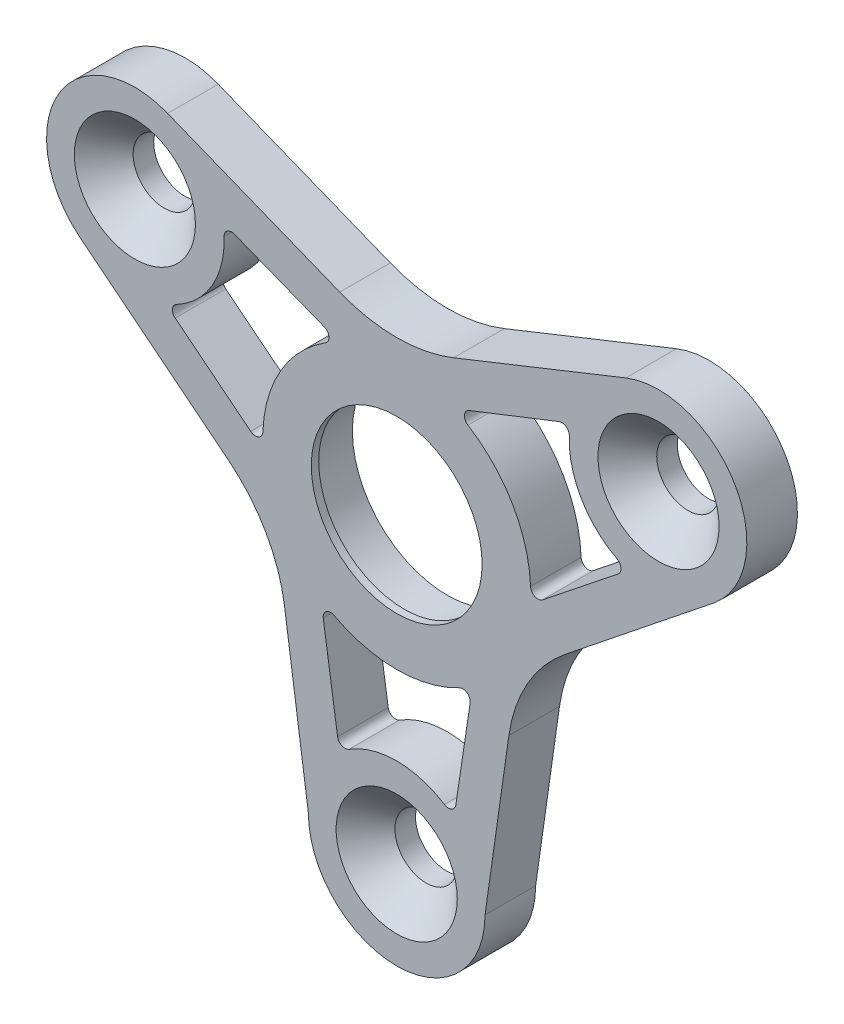
from build123d import *

# Parameters (mm, degrees)
SKETCH_1_R          = 5.935
SKETCH_1_R_2        = 2.095
SKETCH_1_R_3        = 5.74
EXTRUDE_1_DEPTH     = 3.4
SKETCH_3_R          = 6.38
CUT_EXTRUDE_1_DEPTH = 2.9
SKETCH_4_R          = 4.5
EXTRUDE_3_DEPTH     = 0.56
SKETCH_6_R          = 3.15
CUT_EXTRUDE_2_DEPTH = 0.6
SKETCH_7_R          = 3.15
CUT_EXTRUDE_3_DEPTH = 0.6
SKETCH_8_R          = 3.15
CUT_EXTRUDE_4_DEPTH = 0.6
CUT_EXTRUDE_5_DEPTH = 10
SKETCH_13_R         = 4.5
SKETCH_13_R_2       = 3.15
CUT_EXTRUDE_6_DEPTH = 0.37
SKETCH_14_R         = 4.5
SKETCH_14_R_2       = 3.15
CUT_EXTRUDE_7_DEPTH = 0.37
SKETCH_15_R         = 4.5
SKETCH_15_R_2       = 3.15
CUT_EXTRUDE_8_DEPTH = 0.37


with BuildPart() as part:
    # 草图1 → 凸台-拉伸1 (new body)
    # profile 1 of 4: a face of its own
    with BuildSketch(Plane.XY):
        with Locations((-17.593306078, 10.1575)):
            Circle(SKETCH_1_R)
        with Locations((-17.593306078, 10.1575)):
            Circle(SKETCH_1_R_2, mode=Mode.SUBTRACT)
    # profile 2 of 4: a face of its own
    with BuildSketch(Plane.XY):
        with Locations((17.593306078, 10.1575)):
            Circle(SKETCH_1_R)
        with Locations((17.593306078, 10.1575)):
            Circle(SKETCH_1_R_2, mode=Mode.SUBTRACT)
    # profile 3 of 4: a face of its own
    with BuildSketch(Plane.XY):
        with BuildLine():
            Line((-3.823709102, 11.054508427), (-15.39430283, 15.670086481))
            ThreePointArc((-15.39430283, 15.670086481), (-12.680297362, 13.487150186), (-11.658306078, 10.1575))
            ThreePointArc((-11.658306078, 10.1575), (-15.021547784, 4.808641778), (-21.299513922, 5.521958132))
            Line((-21.299513922, 5.521958132), (-11.31029049, -2.464624515))
            ThreePointArc((-11.31029049, -2.464624515), (-8.793601867, -5.406520994), (-7.538053442, -9.068770941))
            Line((-7.538053442, -9.068770941), (-5.935, -20.315))
            ThreePointArc((-5.935, -20.315), (0, -14.38), (5.935, -20.315))
            Line((5.935, -20.315), (7.538053442, -9.068770941))
            ThreePointArc((7.538053442, -9.068770941), (8.793601867, -5.406520994), (11.31029049, -2.464624515))
            Line((11.31029049, -2.464624515), (21.299513922, 5.521958132))
            ThreePointArc((21.299513922, 5.521958132), (12.46358448, 7.172507316), (15.39430283, 15.670086481))
            Line((15.39430283, 15.670086481), (3.823709102, 11.054508427))
            ThreePointArc((3.823709102, 11.054508427), (0, 10.32), (-3.823709102, 11.054508427))
        make_face()
        Circle(SKETCH_1_R_3, mode=Mode.SUBTRACT)
    # profile 4 of 4: a face of its own
    with BuildSketch(Plane.XY):
        with Locations((0, -20.315)):
            Circle(SKETCH_1_R)
        with Locations((0, -20.315)):
            Circle(SKETCH_1_R_2, mode=Mode.SUBTRACT)
    extrude(amount=EXTRUDE_1_DEPTH)

    # 草图3 → 切除-拉伸1 (cut)
    with BuildSketch(Plane(origin=(0, 0, 0), x_dir=(-1, 0, 0), z_dir=(0, 0, -1))):
        Circle(SKETCH_3_R)
    extrude(amount=-CUT_EXTRUDE_1_DEPTH, mode=Mode.SUBTRACT)

    # 草图4 → 凸台-拉伸3 (add)
    with BuildSketch(Plane(origin=(0, 0, 0), x_dir=(-1, 0, 0), z_dir=(0, 0, -1))):
        with Locations(Location((0, -20.315, 0), (0, 0, 180))):
            Circle(SKETCH_4_R)
        with Locations(Location((17.593306078, 10.1575, 0), (0, 0, 180))):
            Circle(SKETCH_4_R)
        with Locations(Location((-17.593306078, 10.1575, 0), (0, 0, 180))):
            Circle(SKETCH_4_R)
    extrude(amount=EXTRUDE_3_DEPTH)

    # 草图6 → 切除-拉伸2 (cut)
    with BuildSketch(Plane(origin=(0, 0, -0.56), x_dir=(-1, 0, 0), z_dir=(0, 0, -1))):
        with Locations((0, -20.315)):
            Circle(SKETCH_6_R)
    extrude(amount=-CUT_EXTRUDE_2_DEPTH, mode=Mode.SUBTRACT)

    # 草图7 → 切除-拉伸3 (cut)
    with BuildSketch(Plane(origin=(0, 0, -0.56), x_dir=(-1, 0, 0), z_dir=(0, 0, -1))):
        with Locations((-17.593306078, 10.1575)):
            Circle(SKETCH_7_R)
    extrude(amount=-CUT_EXTRUDE_3_DEPTH, mode=Mode.SUBTRACT)

    # 草图8 → 切除-拉伸4 (cut)
    with BuildSketch(Plane(origin=(0, 0, -0.56), x_dir=(-1, 0, 0), z_dir=(0, 0, -1))):
        with Locations((17.593306078, 10.1575)):
            Circle(SKETCH_8_R)
    extrude(amount=-CUT_EXTRUDE_4_DEPTH, mode=Mode.SUBTRACT)

    # 草图9 → 切除-旋转1 (revolve, cut)
    with BuildSketch(Plane(origin=(0, 10.1575, 0), x_dir=(-1, 0, 0), z_dir=(0, -1, 0))):
        Polygon((19.688306078, -3.4), (19.688306078, -1.425), (21.663306078, -3.4), align=None)
    revolve(axis=Axis((-17.593306078, 10.1575, 3.4), (0, 0, -1)), mode=Mode.SUBTRACT)

    # 草图10 → 切除-旋转2 (revolve, cut)
    with BuildSketch(Plane(origin=(8.796653039, -5.07875, 0), x_dir=(0, 0, 1), z_dir=(-0.8660254037844397, 0.49999999999999806, 0)), mode=Mode.PRIVATE) as cut_revolve_2_sk:
        Polygon((3.4, 19.688306078), (3.4, 21.663306078), (1.425, 19.688306078), align=None)
    revolve(cut_revolve_2_sk.sketch.rotate(Axis((17.593306078, 10.1575, 3.4), (0, 0, -1)), 240), axis=Axis((17.593306078, 10.1575, 3.4), (0, 0, -1)), mode=Mode.SUBTRACT)

    # 草图11 → 切除-旋转3 (revolve, cut)
    with BuildSketch(Plane(origin=(8.796653039, -5.07875, 0), x_dir=(0, 0, 1), z_dir=(-0.8660254037844397, 0.49999999999999806, 0)), mode=Mode.PRIVATE) as cut_revolve_3_sk:
        Polygon((3.4, -15.498306078), (3.4, -13.523306078), (1.425, -15.498306078), align=None)
    revolve(cut_revolve_3_sk.sketch.rotate(Axis((0, -20.315, 3.4), (0, 0, -1)), 240), axis=Axis((0, -20.315, 3.4), (0, 0, -1)), mode=Mode.SUBTRACT)

    # 草图12 → 切除-拉伸5 (cut)
    with BuildSketch(Plane(origin=(0, 0, 0), x_dir=(-1, 0, 0), z_dir=(0, 0, -1))):
        with BuildLine():
            Line((9.80504906, -0.039344726), (14.886999287, 4.00948902))
            ThreePointArc((14.886999287, 4.00948902), (15.07318502, 4.447954395), (14.80758098, 4.843392767))
            ThreePointArc((14.80758098, 4.843392767), (12.397153655, 7.1575), (11.598291667, 10.402044914))
            ThreePointArc((11.598291667, 10.402044914), (11.388634011, 10.829783946), (10.915818991, 10.887775059))
            Line((10.915818991, 10.887775059), (4.868450998, 8.511093935))
            ThreePointArc((4.868450998, 8.511093935), (4.553503625, 8.092216181), (4.785479185, 7.622282399))
            ThreePointArc((4.785479185, 7.622282399), (7.794228634, 4.5), (8.993829785, 0.333205344))
            ThreePointArc((8.993829785, 0.333205344), (9.284816598, -0.102658275), (9.80504906, -0.039344726))
        make_face()
        with BuildLine():
            Line((3.971180296, -14.897264079), (4.936598062, -8.471749209))
            ThreePointArc((4.936598062, -8.471749209), (4.731312973, -7.989557906), (4.2083506, -7.955487743))
            ThreePointArc((4.2083506, -7.955487743), (0, -9), (-4.2083506, -7.955487743))
            ThreePointArc((-4.2083506, -7.955487743), (-4.731312973, -7.989557906), (-4.936598062, -8.471749209))
            Line((-4.936598062, -8.471749209), (-3.971180296, -14.897264079))
            ThreePointArc((-3.971180296, -14.897264079), (-3.684551009, -15.277738341), (-3.209289313, -15.245437681))
            ThreePointArc((-3.209289313, -15.245437681), (0, -14.315), (3.209289313, -15.245437681))
            ThreePointArc((3.209289313, -15.245437681), (3.684551009, -15.277738341), (3.971180296, -14.897264079))
        make_face()
        with BuildLine():
            Line((-4.868450998, 8.511093935), (-10.915818991, 10.887775059))
            ThreePointArc((-10.915818991, 10.887775059), (-11.388634011, 10.829783946), (-11.598291667, 10.402044914))
            ThreePointArc((-11.598291667, 10.402044914), (-11.594552605, 10.279797865), (-11.593306078, 10.1575))
            ThreePointArc((-11.593306078, 10.1575), (-12.459382111, 7.052210206), (-14.80758098, 4.843392767))
            ThreePointArc((-14.80758098, 4.843392767), (-15.07318502, 4.447954395), (-14.886999287, 4.00948902))
            Line((-14.886999287, 4.00948902), (-9.80504906, -0.039344726))
            ThreePointArc((-9.80504906, -0.039344726), (-9.284816598, -0.102658275), (-8.993829785, 0.333205344))
            ThreePointArc((-8.993829785, 0.333205344), (-7.794228634, 4.5), (-4.785479185, 7.622282399))
            ThreePointArc((-4.785479185, 7.622282399), (-4.553503625, 8.092216181), (-4.868450998, 8.511093935))
        make_face()
    extrude(amount=-CUT_EXTRUDE_5_DEPTH, mode=Mode.SUBTRACT)

    # 草图13 → 切除-拉伸6 (cut)
    with BuildSketch(Plane(origin=(0, 0, -0.56), x_dir=(-1, 0, 0), z_dir=(0, 0, -1))):
        with Locations(Location((0, -20.315, 0), (0, 0, 180))):
            Circle(SKETCH_13_R)
        with Locations((0, -20.315)):
            Circle(SKETCH_13_R_2, mode=Mode.SUBTRACT)
    extrude(amount=-CUT_EXTRUDE_6_DEPTH, mode=Mode.SUBTRACT)

    # 草图14 → 切除-拉伸7 (cut)
    with BuildSketch(Plane(origin=(0, 0, -0.56), x_dir=(-1, 0, 0), z_dir=(0, 0, -1))):
        with Locations(Location((-17.593306078, 10.1575, 0), (0, 0, 180))):
            Circle(SKETCH_14_R)
        with Locations((-17.593306078, 10.1575)):
            Circle(SKETCH_14_R_2, mode=Mode.SUBTRACT)
    extrude(amount=-CUT_EXTRUDE_7_DEPTH, mode=Mode.SUBTRACT)

    # 草图15 → 切除-拉伸8 (cut)
    with BuildSketch(Plane(origin=(0, 0, -0.56), x_dir=(-1, 0, 0), z_dir=(0, 0, -1))):
        with Locations(Location((17.593306078, 10.1575, 0), (0, 0, 180))):
            Circle(SKETCH_15_R)
        with Locations((17.593306078, 10.1575)):
            Circle(SKETCH_15_R_2, mode=Mode.SUBTRACT)
    extrude(amount=-CUT_EXTRUDE_8_DEPTH, mode=Mode.SUBTRACT)


solid = part.part
